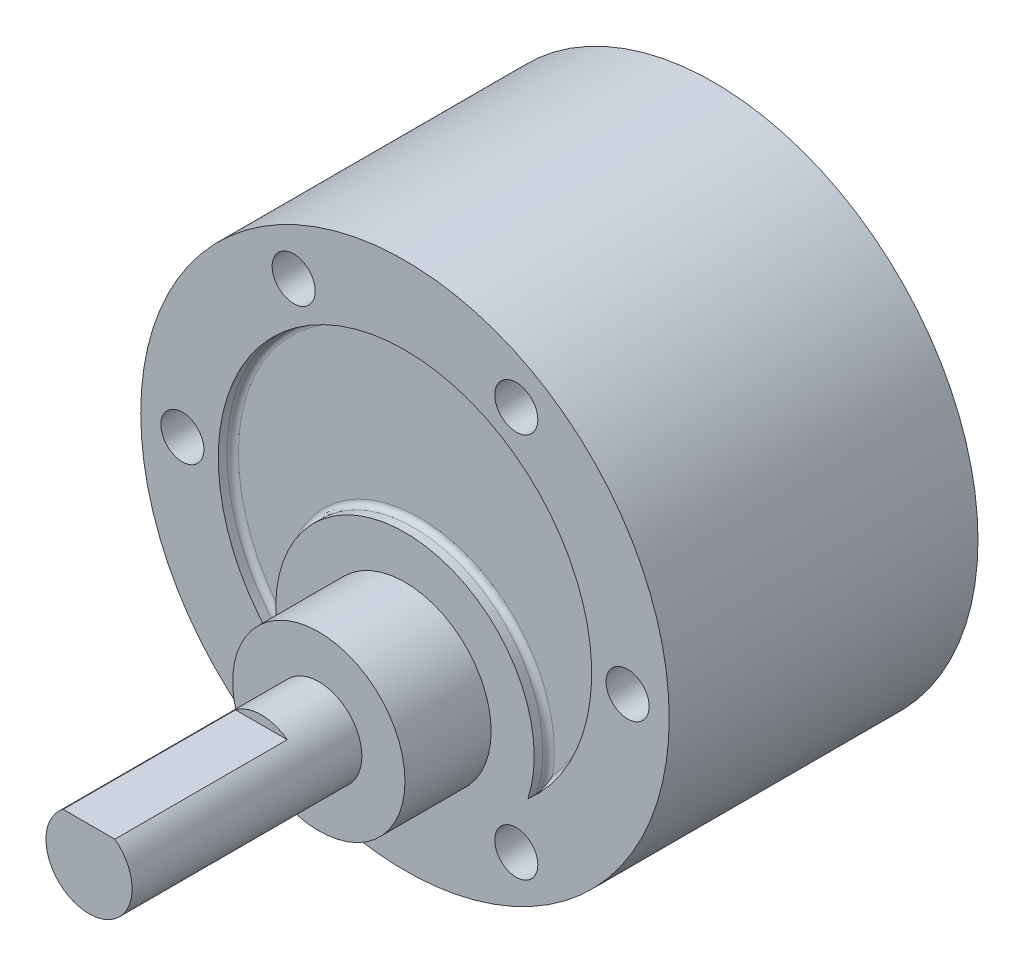
from build123d import *

# Parameters (mm, degrees)
CROQUIS1_R              = 18.4
SALIENTE_EXTRUIR1_DEPTH = 21.5
CROQUIS3_R              = 6
SALIENTE_EXTRUIR2_DEPTH = 6
SALIENTE_EXTRUIR3_DEPTH = 16
SALIENTE_EXTRUIR4_DEPTH = 4
CORTAR_EXTRUIR1_DEPTH   = 1
REDONDEO4_R             = 0.4
CROQUIS7_R              = 1.5
CORTAR_EXTRUIR2_DEPTH   = 3


with BuildPart() as part:
    # Croquis1 → Saliente-Extruir1 (new body)
    with BuildSketch(Plane.XY):
        Circle(CROQUIS1_R)
    extrude(amount=SALIENTE_EXTRUIR1_DEPTH)

    # Croquis3 → Saliente-Extruir2 (add)
    with BuildSketch(Plane.XY.offset(21.5)):
        with Locations((0, -7)):
            Circle(CROQUIS3_R)
    extrude(amount=SALIENTE_EXTRUIR2_DEPTH)

    # Croquis4 → Saliente-Extruir3 (add)
    with BuildSketch(Plane.XY.offset(27.5)):
        with BuildLine():
            Line((1.8, -4.6), (-1.8, -4.6))
            ThreePointArc((-1.8, -4.6), (0, -10), (1.8, -4.6))
        make_face()
    extrude(amount=SALIENTE_EXTRUIR3_DEPTH)

    # Croquis5 → Saliente-Extruir4 (add)
    with BuildSketch(Plane.XY.offset(27.5)):
        with BuildLine():
            Line((-1.8, -4.6), (1.8, -4.6))
            ThreePointArc((1.8, -4.6), (0, -4), (-1.8, -4.6))
        make_face()
    extrude(amount=SALIENTE_EXTRUIR4_DEPTH)

    # Croquis6 → Cortar-Extruir1 (cut)
    with BuildSketch(Plane.XY.offset(21.5)):
        with BuildLine():
            ThreePointArc((8.558025235, -9.785714286), (0, 13), (-8.558025235, -9.785714286))
            ThreePointArc((-8.558025235, -9.785714286), (0, 2), (8.558025235, -9.785714286))
        make_face()
    extrude(amount=-CORTAR_EXTRUIR1_DEPTH, mode=Mode.SUBTRACT)

    # Redondeo4
    redondeo4_edges = [part.edges().sort_by_distance(p)[0] for p in [
        (0, 2, 20.5),
        (0, 13, 20.5),
    ]]
    fillet(redondeo4_edges, radius=REDONDEO4_R)

    # Croquis7 → Cortar-Extruir2 (cut)
    with BuildSketch(Plane.XY.offset(21.5)):
        with Locations((-15.4999946, 0)):
            Circle(CROQUIS7_R)
        with Locations((-7.7499973, 13.423389082)):
            Circle(CROQUIS7_R)
        with Locations((7.7499973, 13.423389082)):
            Circle(CROQUIS7_R)
        with Locations((15.4999946, 0)):
            Circle(CROQUIS7_R)
        with Locations((7.7499973, -13.423389082)):
            Circle(CROQUIS7_R)
        with Locations((-7.7499973, -13.423389082)):
            Circle(CROQUIS7_R)
    extrude(amount=-CORTAR_EXTRUIR2_DEPTH, mode=Mode.SUBTRACT)


solid = part.part
